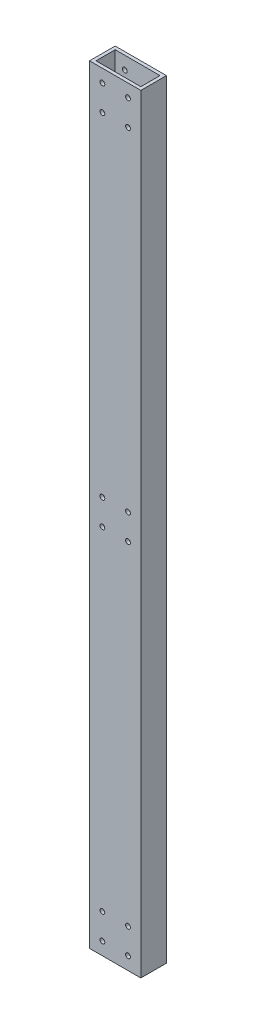
from build123d import *

# Parameters (mm, degrees)
SKETCH1_W               = 50.8
SKETCH1_H               = 25.4
BOSS_EXTRUDE1_DEPTH     = 381
SHELL1_T                = -3.175
CUT_EXTRUDE2_DEPTH      = 383.689587002
CUT_EXTRUDE2_DEPTH_BACK = 383.689587002
SKETCH5_R               = 2.38125


with BuildPart() as part:
    # Sketch1 → Boss-Extrude1 (new, symmetric)
    with BuildSketch(Plane(origin=(0, 0, 0), x_dir=(1, 0, 0), z_dir=(0, 1, 0))):
        Rectangle(SKETCH1_W, SKETCH1_H)
    extrude(amount=BOSS_EXTRUDE1_DEPTH, both=True)

    # Shell1
    shell1_openings = [part.faces().sort_by_distance(p)[0] for p in [
        (0, 381, 0),
        (0, -381, 0),
    ]]
    offset(amount=SHELL1_T, openings=shell1_openings, kind=Kind.INTERSECTION)

    # Sketch5 → Cut-Extrude2 (cut, two sides: drawn at the far end of the back side and taken through both)
    with BuildSketch(Plane.XY.offset(12.7).offset(-CUT_EXTRUDE2_DEPTH_BACK)):
        with Locations((-12.7, 368.3)):
            Circle(SKETCH5_R)
        with Locations((12.7, 368.3)):
            Circle(SKETCH5_R)
        with Locations((12.7, 342.9)):
            Circle(SKETCH5_R)
        with Locations((-12.7, 342.9)):
            Circle(SKETCH5_R)
        with Locations((-12.7, -342.9)):
            Circle(SKETCH5_R)
        with Locations((12.7, -342.9)):
            Circle(SKETCH5_R)
        with Locations((12.7, -368.3)):
            Circle(SKETCH5_R)
        with Locations((-12.7, -368.3)):
            Circle(SKETCH5_R)
        with Locations((-12.7, 12.7)):
            Circle(SKETCH5_R)
        with Locations((12.7, 12.7)):
            Circle(SKETCH5_R)
        with Locations((12.7, -12.7)):
            Circle(SKETCH5_R)
        with Locations((-12.7, -12.7)):
            Circle(SKETCH5_R)
    extrude(amount=CUT_EXTRUDE2_DEPTH + CUT_EXTRUDE2_DEPTH_BACK, mode=Mode.SUBTRACT)


solid = part.part
